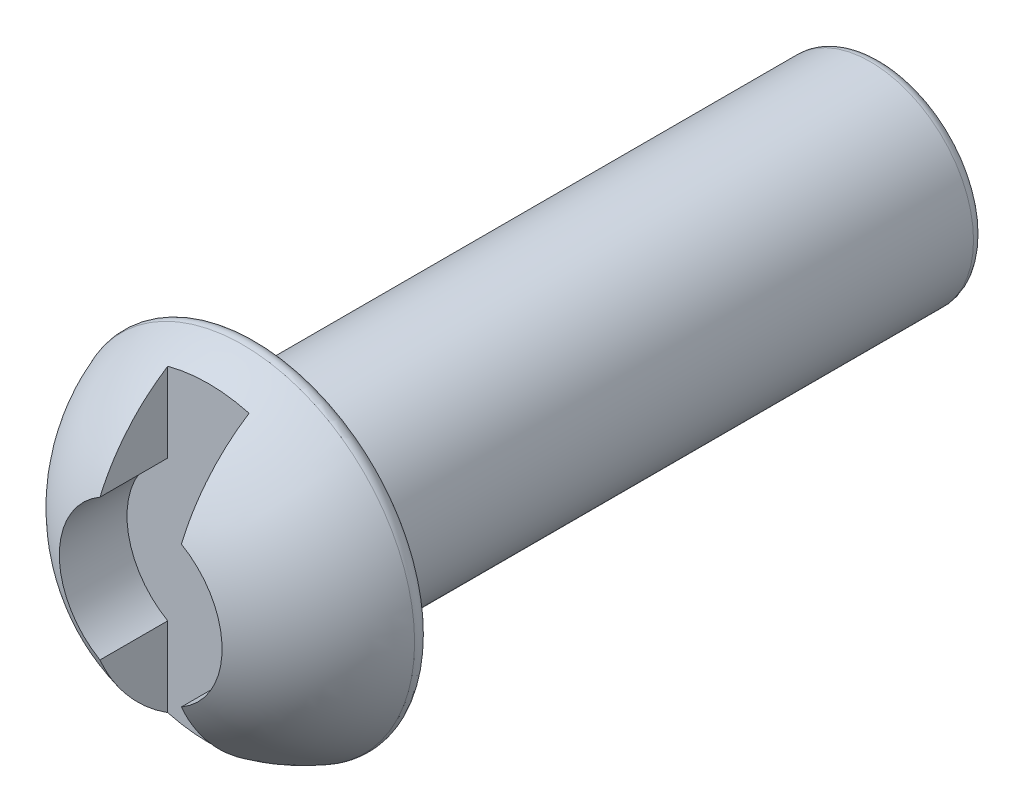
from build123d import *

# Parameters (mm, degrees)
CUT_EXTRUDE1_DEPTH = 0.8
FILLET1_R          = 0.1
FILLET2_R          = 0.1


with BuildPart() as part:
    # Sketch1 → Revolve1 (revolve)
    with BuildSketch(Plane(origin=(0, 0, 0), x_dir=(0, 0, -1), z_dir=(1, 0, 0)), mode=Mode.PRIVATE) as revolve1_sk:
        with BuildLine():
            Line((0, 0), (7, 0))
            Line((7, 0), (7, 0.95))
            Line((7, 0.95), (1.25, 0.95))
            Line((1.25, 0.95), (1.25, 1.625))
            ThreePointArc((1.25, 1.625), (0.348391423, 1.025275828), (0, 0))
        make_face()
    revolve(revolve1_sk.sketch.rotate(Axis((0, 0, 0), (0, 0, -1)), 90), axis=Axis((0, 0, 0), (0, 0, -1)))

    # Sketch2 → Cut-Extrude1 (cut)
    with BuildSketch(Plane.XY):
        with BuildLine():
            Line((-0.375, -2.059291796), (0.375, -2.059291796))
            Line((0.375, -2.059291796), (0.375, -0.649519053))
            ThreePointArc((0.375, -0.649519053), (0.75, 0), (0.375, 0.649519053))
            Line((0.375, 0.649519053), (0.375, 2.059291796))
            Line((0.375, 2.059291796), (-0.375, 2.059291796))
            Line((-0.375, 2.059291796), (-0.375, 0.649519053))
            ThreePointArc((-0.375, 0.649519053), (-0.75, 0), (-0.375, -0.649519053))
            Line((-0.375, -0.649519053), (-0.375, -2.059291796))
        make_face()
    extrude(amount=-CUT_EXTRUDE1_DEPTH, mode=Mode.SUBTRACT)

    # Fillet1
    fillet1_edges = [part.edges().sort_by_distance(p)[0] for p in [
        (-1.625, 0, -1.25),
    ]]
    fillet(fillet1_edges, radius=FILLET1_R)

    # Fillet2
    fillet2_edges = [part.edges().sort_by_distance(p)[0] for p in [
        (-0.95, 0, -7),
    ]]
    fillet(fillet2_edges, radius=FILLET2_R)


solid = part.part
